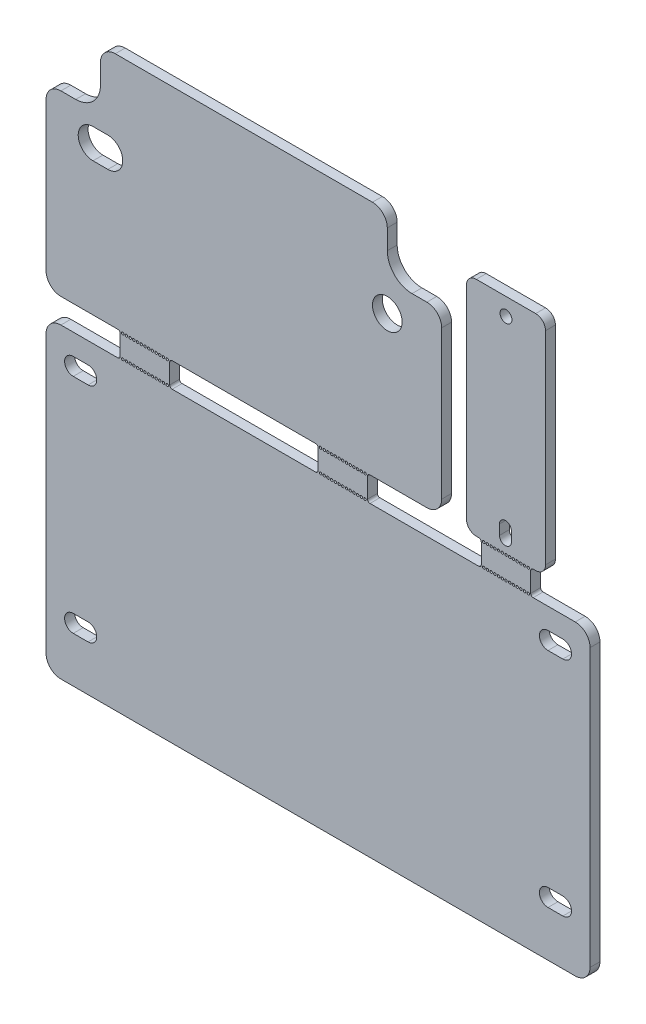
from build123d import *

# Parameters (mm, degrees)
SKETCH_1_W          = 110
SKETCH_1_H          = 65
EXTRUDE_1_DEPTH     = 2
FILLET_1_R          = 3
SKETCH_2_R          = 3
EXTRUDE_2_DEPTH     = 2
FILLET_5_R          = 3
FILLET_6_R          = 5
SKETCH_4_W          = 10
SKETCH_4_H          = 5
EXTRUDE_4_DEPTH     = 2
FILLET_7_R          = 0.5
SKETCH_5_W          = 16
SKETCH_5_H          = 45
SKETCH_5_R          = 1.2
EXTRUDE_5_DEPTH     = 2
SKETCH_6_W          = 10
SKETCH_6_H          = 5
SKETCH_6_W_2        = 5
SKETCH_6_H_2        = 10
EXTRUDE_6_DEPTH     = 2
FILLET_8_R          = 0.5
FILLET_9_R          = 2
SKETCH_7_W          = 110
SKETCH_7_H          = 3
CUT_EXTRUDE_1_DEPTH = 10
FILLET_10_R         = 3
SKETCH_8_R          = 0.25
CUT_EXTRUDE_2_DEPTH = 10
SKETCH_10_W         = 5
SKETCH_10_H         = 19.84178834
CUT_EXTRUDE_3_DEPTH = 10


with BuildPart() as part:
    # ｽｹｯﾁ1 → ﾎﾞｽ - 押し出し1 (new body)
    with BuildSketch(Plane.XY):
        Rectangle(SKETCH_1_W, SKETCH_1_H)
        with BuildLine():
            Line((-49.5, 24.75), (-46.5, 24.75))
            ThreePointArc((-46.5, 24.75), (-44.75, 26.5), (-46.5, 28.25))
            Line((-46.5, 28.25), (-49.5, 28.25))
            ThreePointArc((-49.5, 28.25), (-51.25, 26.5), (-49.5, 24.75))
        make_face(mode=Mode.SUBTRACT)
        with BuildLine():
            Line((-46.5, -20.25), (-49.5, -20.25))
            ThreePointArc((-49.5, -20.25), (-51.25, -18.5), (-49.5, -16.75))
            Line((-49.5, -16.75), (-46.5, -16.75))
            ThreePointArc((-46.5, -16.75), (-44.75, -18.5), (-46.5, -20.25))
        make_face(mode=Mode.SUBTRACT)
        with BuildLine():
            Line((46.5, -20.25), (49.5, -20.25))
            ThreePointArc((49.5, -20.25), (51.25, -18.5), (49.5, -16.75))
            Line((49.5, -16.75), (46.5, -16.75))
            ThreePointArc((46.5, -16.75), (44.75, -18.5), (46.5, -20.25))
        make_face(mode=Mode.SUBTRACT)
        with BuildLine():
            Line((46.5, 28.25), (49.5, 28.25))
            ThreePointArc((49.5, 28.25), (51.25, 26.5), (49.5, 24.75))
            Line((49.5, 24.75), (46.5, 24.75))
            ThreePointArc((46.5, 24.75), (44.75, 26.5), (46.5, 28.25))
        make_face(mode=Mode.SUBTRACT)
    extrude(amount=EXTRUDE_1_DEPTH)

    # ﾌｨﾚｯﾄ1
    fillet_1_edges = [part.edges().sort_by_distance(p)[0] for p in [
        (-55, 32.5, 1),
        (55, 32.5, 1),
    ]]
    fillet(fillet_1_edges, radius=FILLET_1_R)



with BuildPart() as body_2:
    # ｽｹｯﾁ2 → ﾎﾞｽ - 押し出し2 (new body)
    with BuildSketch(Plane.XY.offset(2)):
        Polygon((-55, 37.5), (25, 37.5), (25, 73.5), (14, 73.5), (14, 85.5), (-44, 85.5), (-44, 73.5), (-55, 73.5), align=None)
        with Locations((14, 67.5)):
            Circle(SKETCH_2_R, mode=Mode.SUBTRACT)
        with BuildLine():
            Line((-45.5, 64.5), (-42.5, 64.5))
            ThreePointArc((-42.5, 64.5), (-39.5, 67.5), (-42.5, 70.5))
            Line((-42.5, 70.5), (-45.5, 70.5))
            ThreePointArc((-45.5, 70.5), (-48.5, 67.5), (-45.5, 64.5))
        make_face(mode=Mode.SUBTRACT)
    extrude(amount=-EXTRUDE_2_DEPTH)

    # ﾌｨﾚｯﾄ5
    fillet_5_edges = [body_2.edges().sort_by_distance(p)[0] for p in [
        (25, 37.5, 1),
        (-55, 37.5, 1),
        (-55, 73.5, 1),
        (-44, 85.5, 1),
        (14, 85.5, 1),
        (25, 73.5, 1),
    ]]
    fillet(fillet_5_edges, radius=FILLET_5_R)

    # ﾌｨﾚｯﾄ6
    fillet_6_edges = [body_2.edges().sort_by_distance(p)[0] for p in [
        (-44, 73.5, 1),
        (14, 73.5, 1),
    ]]
    fillet(fillet_6_edges, radius=FILLET_6_R)


with BuildPart() as part_1:
    add(part.part)

    add(body_2.part)  # ﾎﾞｽ - 押し出し4 merges body 2
    # ｽｹｯﾁ4 → ﾎﾞｽ - 押し出し4 (add)
    with BuildSketch(Plane.XY.offset(2)):
        with Locations((-35, 35)):
            Rectangle(SKETCH_4_W, SKETCH_4_H)
        with Locations((5, 35)):
            Rectangle(SKETCH_4_W, SKETCH_4_H)
    extrude(amount=-EXTRUDE_4_DEPTH)

    # ﾌｨﾚｯﾄ7
    fillet_7_edges = [part_1.edges().sort_by_distance(p)[0] for p in [
        (0, 37.5, 1),
        (10, 37.5, 1),
        (10, 32.5, 1),
        (0, 32.5, 1),
        (-40, 37.5, 1),
        (-30, 37.5, 1),
        (-30, 32.5, 1),
        (-40, 32.5, 1),
    ]]
    fillet(fillet_7_edges, radius=FILLET_7_R)



with BuildPart() as body_2_2:
    # ｽｹｯﾁ5 → ﾎﾞｽ - 押し出し5 (new body)
    with BuildSketch(Plane.XY.offset(2)):
        with Locations((38, 60)):
            Rectangle(SKETCH_5_W, SKETCH_5_H)
        with Locations((38, 79)):
            Circle(SKETCH_5_R, mode=Mode.SUBTRACT)
        with BuildLine():
            Line((36.683223365, 42), (36.683223365, 40))
            ThreePointArc((36.683223365, 40), (37.883223365, 38.8), (39.083223365, 40))
            Line((39.083223365, 40), (39.083223365, 42))
            ThreePointArc((39.083223365, 42), (37.883223365, 43.2), (36.683223365, 42))
        make_face(mode=Mode.SUBTRACT)
    extrude(amount=-EXTRUDE_5_DEPTH)


with BuildPart() as part_2:
    add(part_1.part)

    add(body_2_2.part)  # ﾎﾞｽ - 押し出し6 merges body 2 2
    # ｽｹｯﾁ6 → ﾎﾞｽ - 押し出し6 (add)
    with BuildSketch(Plane.XY.offset(2)):
        with Locations((38, 35)):
            Rectangle(SKETCH_6_W, SKETCH_6_H)
        with Locations((27.5, 60.5)):
            Rectangle(SKETCH_6_W_2, SKETCH_6_H_2)
    extrude(amount=-EXTRUDE_6_DEPTH)

    # ﾌｨﾚｯﾄ8
    fillet_8_edges = [part_2.edges().sort_by_distance(p)[0] for p in [
        (33, 37.5, 1),
        (43, 37.5, 1),
        (43, 32.5, 1),
        (33, 32.5, 1),
        (25, 55.5, 1),
        (25, 65.5, 1),
        (30, 65.5, 1),
        (30, 55.5, 1),
    ]]
    fillet(fillet_8_edges, radius=FILLET_8_R)

    # ﾌｨﾚｯﾄ9
    fillet_9_edges = [part_2.edges().sort_by_distance(p)[0] for p in [
        (46, 37.5, 1),
        (46, 82.5, 1),
        (30, 37.5, 1),
        (30, 82.5, 1),
    ]]
    fillet(fillet_9_edges, radius=FILLET_9_R)

    # ｽｹｯﾁ7 → ｶｯﾄ - 押し出し1 (cut)
    with BuildSketch(Plane.XY.offset(2)):
        with Locations((0, -31)):
            Rectangle(SKETCH_7_W, SKETCH_7_H)
    extrude(amount=-CUT_EXTRUDE_1_DEPTH, mode=Mode.SUBTRACT)

    # ﾌｨﾚｯﾄ10
    fillet_10_edges = [part_2.edges().sort_by_distance(p)[0] for p in [
        (55, -29.5, 1),
        (-55, -29.5, 1),
    ]]
    fillet(fillet_10_edges, radius=FILLET_10_R)

    # ｽｹｯﾁ8 → ｶｯﾄ - 押し出し2 (cut)
    with BuildSketch(Plane.XY.offset(2)):
        with Locations((-39.5, 37.25)):
            Circle(SKETCH_8_R)
        with Locations((-38.75, 37.25)):
            Circle(SKETCH_8_R)
        with Locations((-38, 37.25)):
            Circle(SKETCH_8_R)
        with Locations((-37.25, 37.25)):
            Circle(SKETCH_8_R)
        with Locations((-36.5, 37.25)):
            Circle(SKETCH_8_R)
        with Locations((-35.75, 37.25)):
            Circle(SKETCH_8_R)
        with Locations((-35, 37.25)):
            Circle(SKETCH_8_R)
        with Locations((-34.25, 37.25)):
            Circle(SKETCH_8_R)
        with Locations((-33.5, 37.25)):
            Circle(SKETCH_8_R)
        with Locations((-32.75, 37.25)):
            Circle(SKETCH_8_R)
        with Locations((-32, 37.25)):
            Circle(SKETCH_8_R)
        with Locations((-31.25, 37.25)):
            Circle(SKETCH_8_R)
        with Locations((-30.5, 37.25)):
            Circle(SKETCH_8_R)
        with Locations(Location((-30.5, 32.75, 0), (0, 0, 180))):
            Circle(SKETCH_8_R)
        with Locations(Location((-31.25, 32.75, 0), (0, 0, 180))):
            Circle(SKETCH_8_R)
        with Locations(Location((-32, 32.75, 0), (0, 0, 180))):
            Circle(SKETCH_8_R)
        with Locations(Location((-32.75, 32.75, 0), (0, 0, 180))):
            Circle(SKETCH_8_R)
        with Locations(Location((-33.5, 32.75, 0), (0, 0, 180))):
            Circle(SKETCH_8_R)
        with Locations(Location((-34.25, 32.75, 0), (0, 0, 180))):
            Circle(SKETCH_8_R)
        with Locations(Location((-35, 32.75, 0), (0, 0, 180))):
            Circle(SKETCH_8_R)
        with Locations(Location((-35.75, 32.75, 0), (0, 0, 180))):
            Circle(SKETCH_8_R)
        with Locations(Location((-36.5, 32.75, 0), (0, 0, 180))):
            Circle(SKETCH_8_R)
        with Locations(Location((-37.25, 32.75, 0), (0, 0, 180))):
            Circle(SKETCH_8_R)
        with Locations(Location((-38, 32.75, 0), (0, 0, 180))):
            Circle(SKETCH_8_R)
        with Locations(Location((-38.75, 32.75, 0), (0, 0, 180))):
            Circle(SKETCH_8_R)
        with Locations(Location((-39.5, 32.75, 0), (0, 0, 180))):
            Circle(SKETCH_8_R)
        with Locations((0.5, 32.75)):
            Circle(SKETCH_8_R)
        with Locations((1.25, 32.75)):
            Circle(SKETCH_8_R)
        with Locations((2, 32.75)):
            Circle(SKETCH_8_R)
        with Locations((2.75, 32.75)):
            Circle(SKETCH_8_R)
        with Locations((3.5, 32.75)):
            Circle(SKETCH_8_R)
        with Locations((4.25, 32.75)):
            Circle(SKETCH_8_R)
        with Locations((5, 32.75)):
            Circle(SKETCH_8_R)
        with Locations((5.75, 32.75)):
            Circle(SKETCH_8_R)
        with Locations((6.5, 32.75)):
            Circle(SKETCH_8_R)
        with Locations((7.25, 32.75)):
            Circle(SKETCH_8_R)
        with Locations((8, 32.75)):
            Circle(SKETCH_8_R)
        with Locations((8.75, 32.75)):
            Circle(SKETCH_8_R)
        with Locations((9.5, 32.75)):
            Circle(SKETCH_8_R)
        with Locations(Location((0.5, 37.25, 0), (0, 0, 180))):
            Circle(SKETCH_8_R)
        with Locations(Location((1.25, 37.25, 0), (0, 0, 180))):
            Circle(SKETCH_8_R)
        with Locations(Location((2, 37.25, 0), (0, 0, 180))):
            Circle(SKETCH_8_R)
        with Locations(Location((2.75, 37.25, 0), (0, 0, 180))):
            Circle(SKETCH_8_R)
        with Locations(Location((3.5, 37.25, 0), (0, 0, 180))):
            Circle(SKETCH_8_R)
        with Locations(Location((4.25, 37.25, 0), (0, 0, 180))):
            Circle(SKETCH_8_R)
        with Locations(Location((5, 37.25, 0), (0, 0, 180))):
            Circle(SKETCH_8_R)
        with Locations(Location((5.75, 37.25, 0), (0, 0, 180))):
            Circle(SKETCH_8_R)
        with Locations(Location((6.5, 37.25, 0), (0, 0, 180))):
            Circle(SKETCH_8_R)
        with Locations(Location((7.25, 37.25, 0), (0, 0, 180))):
            Circle(SKETCH_8_R)
        with Locations(Location((8, 37.25, 0), (0, 0, 180))):
            Circle(SKETCH_8_R)
        with Locations(Location((8.75, 37.25, 0), (0, 0, 180))):
            Circle(SKETCH_8_R)
        with Locations(Location((9.5, 37.25, 0), (0, 0, 180))):
            Circle(SKETCH_8_R)
        with Locations(Location((33.5, 32.75, 0), (0, 0, 180))):
            Circle(SKETCH_8_R)
        with Locations(Location((34.25, 32.75, 0), (0, 0, 180))):
            Circle(SKETCH_8_R)
        with Locations(Location((35, 32.75, 0), (0, 0, 180))):
            Circle(SKETCH_8_R)
        with Locations(Location((35.75, 32.75, 0), (0, 0, 180))):
            Circle(SKETCH_8_R)
        with Locations(Location((36.5, 32.75, 0), (0, 0, 180))):
            Circle(SKETCH_8_R)
        with Locations(Location((37.25, 32.75, 0), (0, 0, 180))):
            Circle(SKETCH_8_R)
        with Locations(Location((38, 32.75, 0), (0, 0, 180))):
            Circle(SKETCH_8_R)
        with Locations(Location((38.75, 32.75, 0), (0, 0, 180))):
            Circle(SKETCH_8_R)
        with Locations(Location((39.5, 32.75, 0), (0, 0, 180))):
            Circle(SKETCH_8_R)
        with Locations(Location((40.25, 32.75, 0), (0, 0, 180))):
            Circle(SKETCH_8_R)
        with Locations(Location((41, 32.75, 0), (0, 0, 180))):
            Circle(SKETCH_8_R)
        with Locations(Location((41.75, 32.75, 0), (0, 0, 180))):
            Circle(SKETCH_8_R)
        with Locations(Location((42.5, 32.75, 0), (0, 0, 180))):
            Circle(SKETCH_8_R)
        with Locations((33.5, 37.25)):
            Circle(SKETCH_8_R)
        with Locations((34.25, 37.25)):
            Circle(SKETCH_8_R)
        with Locations((35, 37.25)):
            Circle(SKETCH_8_R)
        with Locations((35.75, 37.25)):
            Circle(SKETCH_8_R)
        with Locations((36.5, 37.25)):
            Circle(SKETCH_8_R)
        with Locations((37.25, 37.25)):
            Circle(SKETCH_8_R)
        with Locations((38, 37.25)):
            Circle(SKETCH_8_R)
        with Locations((38.75, 37.25)):
            Circle(SKETCH_8_R)
        with Locations((39.5, 37.25)):
            Circle(SKETCH_8_R)
        with Locations((40.25, 37.25)):
            Circle(SKETCH_8_R)
        with Locations((41, 37.25)):
            Circle(SKETCH_8_R)
        with Locations((41.75, 37.25)):
            Circle(SKETCH_8_R)
        with Locations((42.5, 37.25)):
            Circle(SKETCH_8_R)
    extrude(amount=-CUT_EXTRUDE_2_DEPTH, mode=Mode.SUBTRACT)

    # ｽｹｯﾁ10 → ｶｯﾄ - 押し出し3 (cut)
    with BuildSketch(Plane.XY.offset(2)):
        with Locations((27.5, 60.5)):
            Rectangle(SKETCH_10_W, SKETCH_10_H)
    extrude(amount=-CUT_EXTRUDE_3_DEPTH, mode=Mode.SUBTRACT)


solid = part_2.part
